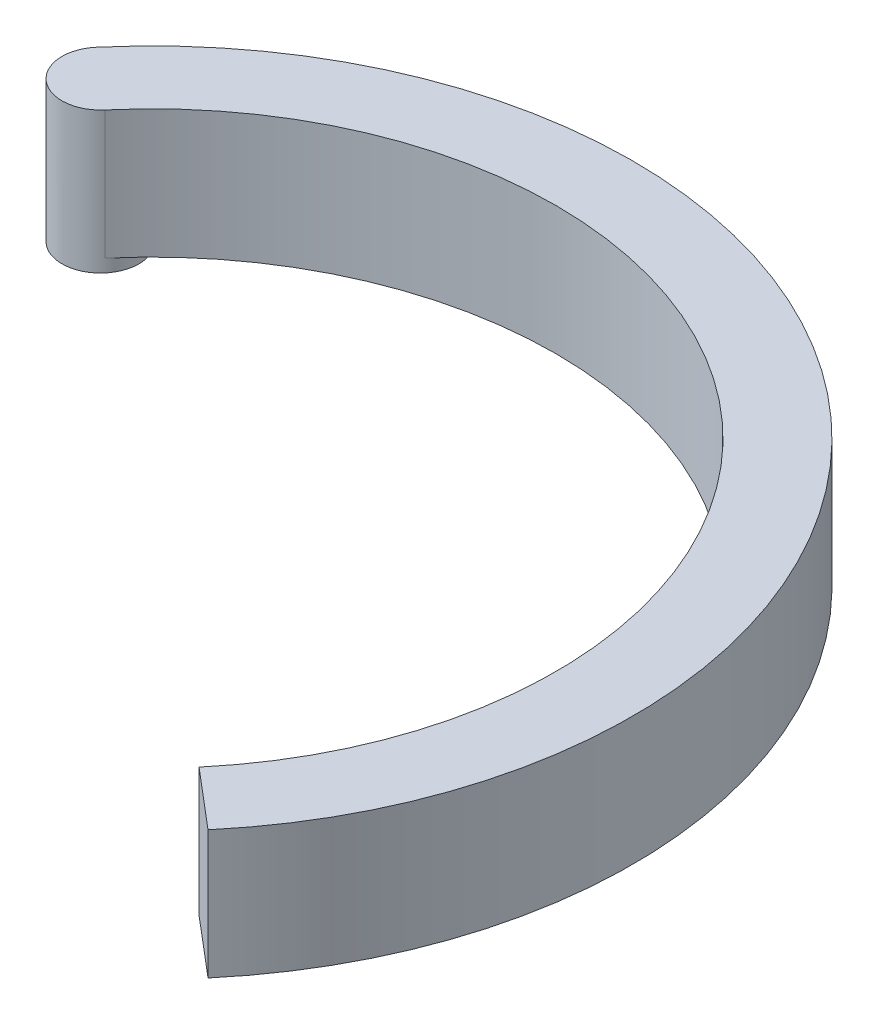
from build123d import *

# Parameters (mm, degrees)
BOSS_EXTRUDE1_DEPTH     = 10
BOSS_EXTRUDE2_START     = 1
SKETCH3_R               = 3
BOSS_EXTRUDE2_DEPTH     = 1
CUT_EXTRUDE1_DEPTH      = 59
CUT_EXTRUDE1_DEPTH_BACK = 104


with BuildPart() as part:
    # Sketch2 → Boss-Extrude1 (new body)
    with BuildSketch(Plane(origin=(0, 0, 0), x_dir=(1, 0, 0), z_dir=(0, 1, 0))):
        with BuildLine():
            ThreePointArc((54.859329632, -46.484559643), (50.497240278, 6.301499085), (-2.28881845, 1.939409731))
            ThreePointArc((-2.28881845, 1.939409731), (-1.939409731, -2.28881845), (2.28881845, -1.939409731))
            ThreePointArc((2.28881845, -1.939409731), (46.618420816, 1.723862186), (50.281692732, -42.605740181))
            ThreePointArc((50.281692732, -42.605740181), (50.631101451, -46.833968361), (54.859329632, -46.484559643))
        make_face()
    extrude(amount=BOSS_EXTRUDE1_DEPTH)

    # Sketch3 → Boss-Extrude2 (add)
    with BuildSketch(Plane.XZ.offset(BOSS_EXTRUDE2_START)):
        with Locations(Location((0, 0, 0), (0, 0, 270))):
            Circle(SKETCH3_R)
    extrude(amount=-BOSS_EXTRUDE2_DEPTH)

    # Sketch4 → Cut-Extrude1 (cut, two sides: drawn at the far end of the back side and taken through both)
    with BuildSketch(Plane.XZ.offset(-CUT_EXTRUDE1_DEPTH_BACK)):
        with BuildLine():
            Line((54.859329632, 46.484559643), (50.281692732, 42.605740181))
            ThreePointArc((50.281692732, 42.605740181), (49.580702363, 44.792219186), (50.631101451, 46.833968361))
            ThreePointArc((50.631101451, 46.833968361), (52.817580456, 47.534958731), (54.859329632, 46.484559643))
        make_face()
    extrude(amount=CUT_EXTRUDE1_DEPTH + CUT_EXTRUDE1_DEPTH_BACK, mode=Mode.SUBTRACT)


solid = part.part
